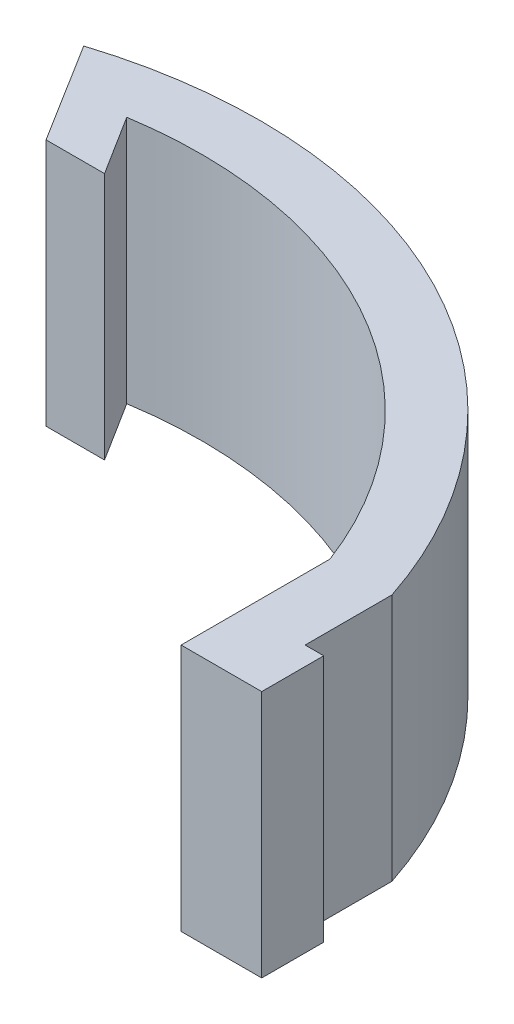
from build123d import *

# Parameters (mm, degrees)
BOSS_EXTRUDE1_DEPTH = 10


with BuildPart() as part:
    # Sketch1 → Boss-Extrude1 (new body)
    with BuildSketch(Plane(origin=(0, 0, 0), x_dir=(1, 0, 0), z_dir=(0, 1, 0))):
        with BuildLine():
            Line((10.071764786, -10.08216391), (10.071764786, -4.08216391))
            ThreePointArc((10.071764786, -4.08216391), (2.323280047, 5.049555768), (-9.449329878, 7.247958729))
            Line((-9.449329878, 7.247958729), (-7.930020486, 4.83354103))
            Line((-7.930020486, 4.83354103), (-10.287570259, 4.83354103))
            Line((-10.287570259, 4.83354103), (-12.805676558, 8.868272387))
            ThreePointArc((-12.805676558, 8.868272387), (2.54603949, 7.611411938), (12.571764786, -4.08216391))
            Line((12.571764786, -4.08216391), (12.571764786, -7.58216391))
            Line((12.571764786, -7.58216391), (13.321764786, -7.58216391))
            Line((13.321764786, -7.58216391), (13.321764786, -10.08216391))
            Line((13.321764786, -10.08216391), (12.571764786, -10.08216391))
            Line((12.571764786, -10.08216391), (10.071764786, -10.08216391))
        make_face()
    extrude(amount=BOSS_EXTRUDE1_DEPTH)


solid = part.part
